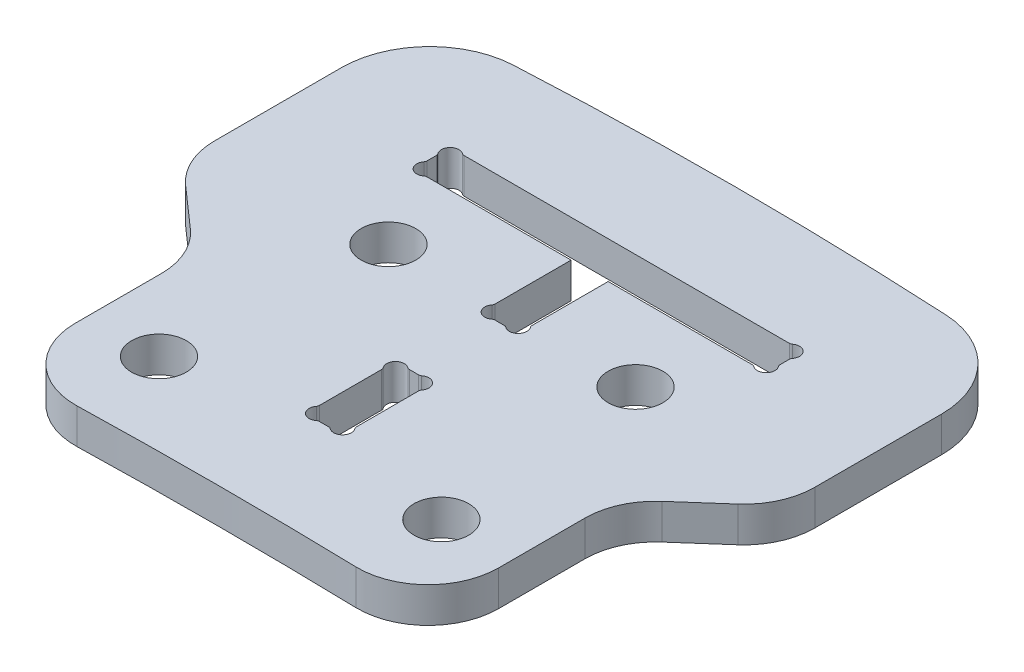
from build123d import *

# Parameters (mm, degrees)
EXTRUDE_1_DEPTH     = 2
SKETCH_2_W          = 1.05
SKETCH_2_H          = 5.1
CUT_EXTRUDE_1_DEPTH = 343.228344823
CUT_EXTRUDE_2_DEPTH = 343.228344823
FILLET_1_R          = 0.2
SKETCH_4_R          = 1.55
CUT_EXTRUDE_3_DEPTH = 343.228344823
FILLET_2_R          = 5
FILLET_3_R          = 4


with BuildPart() as part:
    # 草图1 → 凸台-拉伸1 (new body)
    with BuildSketch(Plane(origin=(0, 0, 0), x_dir=(1, 0, 0), z_dir=(0, 1, 0))):
        with BuildLine():
            Line((-17, 327.5), (-12, 323.088235294))
            Line((-12, 323.088235294), (-12, 312.269515003))
            ThreePointArc((-12, 312.269515003), (0, 312.5), (12, 312.269515003))
            Line((12, 312.269515003), (12, 323.088235294))
            Line((12, 323.088235294), (17, 327.5))
            Line((17, 327.5), (17, 341.184299815))
            ThreePointArc((17, 341.184299815), (0, 341.8), (-17, 341.184299815))
            Line((-17, 341.184299815), (-17, 327.5))
        make_face()
    extrude(amount=EXTRUDE_1_DEPTH)

    # 草图2 → 切除-拉伸1 (cut, through all)
    with BuildSketch(Plane(origin=(0, 2, 0), x_dir=(1, 0, 0), z_dir=(0, 1, 0))):
        Polygon((0, 335.65), (0, 328.45), (1.05, 328.45), (1.05, 333.55), (10, 333.55), (10, 335.65), align=None)
        Polygon((-1.05, 328.45), (0, 328.45), (0, 335.65), (-10, 335.65), (-10, 333.55), (-1.05, 333.55), align=None)
        with Locations((0.525, 321.05)):
            Rectangle(SKETCH_2_W, SKETCH_2_H)
        with Locations((-0.525, 321.05)):
            Rectangle(SKETCH_2_W, SKETCH_2_H)
    extrude(amount=-CUT_EXTRUDE_1_DEPTH, mode=Mode.SUBTRACT)

    # 草图3 → 切除-拉伸2 (cut, through all)
    with BuildSketch(Plane(origin=(0, 2, 0), x_dir=(1, 0, 0), z_dir=(0, 1, 0))):
        with BuildLine():
            Line((10, 335.65), (10, 334.942893219))
            ThreePointArc((10, 334.942893219), (10.108386376, 335.105104893), (10.146446609, 335.296446609))
            ThreePointArc((10.146446609, 335.296446609), (10.108386376, 335.487788326), (10, 335.65))
        make_face()
        with BuildLine():
            ThreePointArc((10, 335.65), (9.646446609, 335.796446609), (9.292893219, 335.65))
            Line((9.292893219, 335.65), (10, 335.65))
        make_face()
        with BuildLine():
            ThreePointArc((10.146446609, 333.903553391), (10.108386376, 334.094895107), (10, 334.257106781))
            Line((10, 334.257106781), (10, 333.55))
            ThreePointArc((10, 333.55), (10.108386376, 333.712211674), (10.146446609, 333.903553391))
        make_face()
        with BuildLine():
            Line((10, 333.55), (9.292893219, 333.55))
            ThreePointArc((9.292893219, 333.55), (9.646446609, 333.403553391), (10, 333.55))
        make_face()
        with BuildLine():
            ThreePointArc((1.196446609, 328.803553391), (1.158386376, 328.994895107), (1.05, 329.157106781))
            Line((1.05, 329.157106781), (1.05, 328.45))
            ThreePointArc((1.05, 328.45), (1.158386376, 328.612211674), (1.196446609, 328.803553391))
        make_face()
        with BuildLine():
            Line((1.05, 328.45), (0.342893219, 328.45))
            ThreePointArc((0.342893219, 328.45), (0.696446609, 328.303553391), (1.05, 328.45))
        make_face()
        with BuildLine():
            ThreePointArc((1.196446609, 323.246446609), (1.158386376, 323.437788326), (1.05, 323.6))
            Line((1.05, 323.6), (1.05, 322.892893219))
            ThreePointArc((1.05, 322.892893219), (1.158386376, 323.055104893), (1.196446609, 323.246446609))
        make_face()
        with BuildLine():
            ThreePointArc((1.05, 323.6), (0.696446609, 323.746446609), (0.342893219, 323.6))
            Line((0.342893219, 323.6), (1.05, 323.6))
        make_face()
        with BuildLine():
            ThreePointArc((1.196446609, 318.853553391), (1.158386376, 319.044895107), (1.05, 319.207106781))
            Line((1.05, 319.207106781), (1.05, 318.5))
            ThreePointArc((1.05, 318.5), (1.158386376, 318.662211674), (1.196446609, 318.853553391))
        make_face()
        with BuildLine():
            Line((1.05, 318.5), (0.342893219, 318.5))
            ThreePointArc((0.342893219, 318.5), (0.696446609, 318.353553391), (1.05, 318.5))
        make_face()
    cut_extrude_2 = extrude(amount=-CUT_EXTRUDE_2_DEPTH, mode=Mode.SUBTRACT)

    # 镜向1: 切除-拉伸2 across plane
    add(cut_extrude_2.mirror(Plane(origin=(0, 0, 0), x_dir=(0, 0, 1), z_dir=(1, 0, 0))), mode=Mode.SUBTRACT)

    # 圆角1
    fillet_1_edges = [part.edges().sort_by_distance(p)[0] for p in [
        (1.05, 1, -329.157106781),
        (0.342893219, 1, -323.6),
        (1.05, 1, -319.207106781),
        (9.292893219, 1, -335.65),
        (10, 1, -334.257106781),
        (0.342893219, 1, -328.45),
        (1.05, 1, -322.892893219),
        (0.342893219, 1, -318.5),
        (-10, 1, -334.942893219),
        (-9.292893219, 1, -333.55),
        (-1.05, 1, -329.157106781),
        (-0.342893219, 1, -323.6),
        (-1.05, 1, -319.207106781),
        (-9.292893219, 1, -335.65),
        (-10, 1, -334.257106781),
        (-0.342893219, 1, -328.45),
        (-1.05, 1, -322.892893219),
        (-0.342893219, 1, -318.5),
        (10, 1, -334.942893219),
        (9.292893219, 1, -333.55),
    ]]
    fillet(fillet_1_edges, radius=FILLET_1_R)

    # 草图4 → 切除-拉伸3 (cut, through all)
    with BuildSketch(Plane(origin=(0, 2, 0), x_dir=(1, 0, 0), z_dir=(0, 1, 0))):
        with Locations(Location((7, 329.15, 0), (0, 0, 270))):
            Circle(SKETCH_4_R)
        with Locations(Location((8, 317.15, 0), (0, 0, 270))):
            Circle(SKETCH_4_R)
    cut_extrude_3 = extrude(amount=-CUT_EXTRUDE_3_DEPTH, mode=Mode.SUBTRACT)

    # 镜向2: 切除-拉伸3 across plane
    add(cut_extrude_3.mirror(Plane(origin=(0, 0, 0), x_dir=(0, 0, 1), z_dir=(1, 0, 0))), mode=Mode.SUBTRACT)

    # 圆角2
    fillet_2_edges = [part.edges().sort_by_distance(p)[0] for p in [
        (-17, 1, -341.184299815),
        (17, 1, -341.184299815),
    ]]
    fillet(fillet_2_edges, radius=FILLET_2_R)

    # 圆角3
    fillet_3_edges = [part.edges().sort_by_distance(p)[0] for p in [
        (17, 1, -327.5),
        (12, 1, -323.088235294),
        (12, 1, -312.269515003),
        (-12, 1, -312.269515003),
        (-12, 1, -323.088235294),
        (-17, 1, -327.5),
    ]]
    fillet(fillet_3_edges, radius=FILLET_3_R)


solid = part.part
